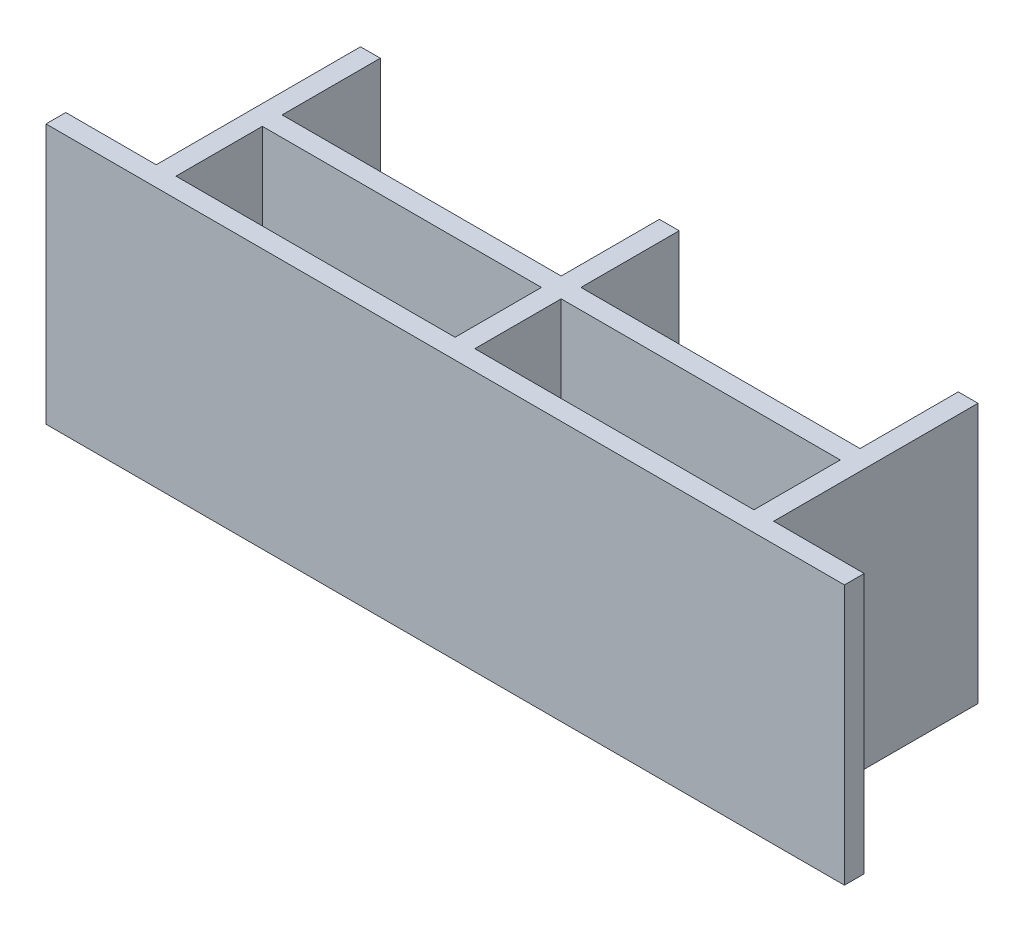
from build123d import *

# Parameters (mm, degrees)
SKETCH1_W           = 101
SKETCH1_H           = 43
BOSS_EXTRUDE1_DEPTH = 32.9
SKETCH4_W           = 101
SKETCH4_H           = 14.656
SKETCH4_W_2         = 11.451
SKETCH4_H_2         = 25.844
SKETCH4_W_3         = 11.445
SKETCH4_W_4         = 35.302
SKETCH4_H_3         = 12.422
SKETCH4_H_4         = 10.922
CUT_EXTRUDE2_DEPTH  = 32.9


with BuildPart() as part:
    # Sketch1 → Boss-Extrude1 (new body)
    with BuildSketch(Plane(origin=(0, 0, 0), x_dir=(1, 0, 0), z_dir=(0, 1, 0))):
        with Locations((50.5, 21.5)):
            Rectangle(SKETCH1_W, SKETCH1_H)
    extrude(amount=BOSS_EXTRUDE1_DEPTH)

    # Sketch4 → Cut-Extrude2 (cut)
    with BuildSketch(Plane(origin=(0, 32.9, 0), x_dir=(1, 0, 0), z_dir=(0, 1, 0))):
        with Locations((50.5, 7.328)):
            Rectangle(SKETCH4_W, SKETCH4_H)
        with Locations((95.2745, 30.078)):
            Rectangle(SKETCH4_W_2, SKETCH4_H_2)
        with Locations((5.7225, 30.078)):
            Rectangle(SKETCH4_W_3, SKETCH4_H_2)
        with Locations((31.596, 36.789)):
            Rectangle(SKETCH4_W_4, SKETCH4_H_3)
        with Locations((69.398, 36.789)):
            Rectangle(SKETCH4_W_4, SKETCH4_H_3)
        with Locations((69.398, 22.617)):
            Rectangle(SKETCH4_W_4, SKETCH4_H_4)
        with Locations((31.596, 22.617)):
            Rectangle(SKETCH4_W_4, SKETCH4_H_4)
    extrude(amount=-CUT_EXTRUDE2_DEPTH, mode=Mode.SUBTRACT)


solid = part.part
